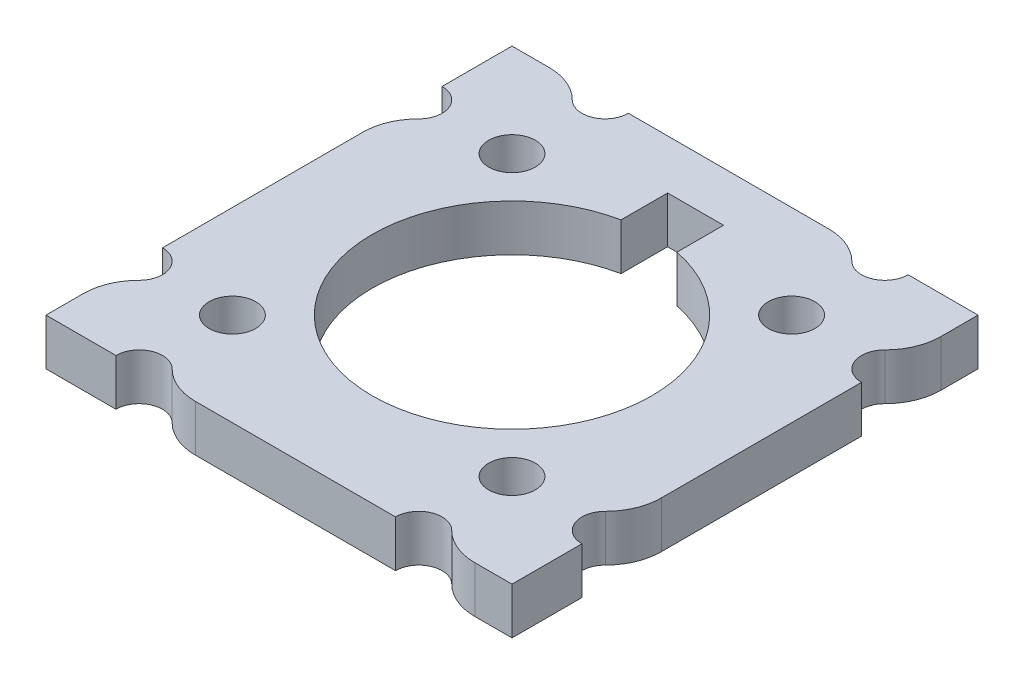
from build123d import *

# Parameters (mm, degrees)
SKETCH1_W           = 50
SKETCH1_H           = 50
SKETCH1_R           = 2.5
BOSS_EXTRUDE1_DEPTH = 5
SKETCH2_R           = 2.5
CUT_EXTRUDE1_DEPTH  = 5
CUT_EXTRUDE2_DEPTH  = 36.707142143
FILLET1_R           = 6


with BuildPart() as part:
    # Sketch1 → Boss-Extrude1 (new body)
    with BuildSketch(Plane(origin=(0, 0, 0), x_dir=(1, 0, 0), z_dir=(0, 1, 0))):
        Rectangle(SKETCH1_W, SKETCH1_H)
        with Locations(Location((15, 15, 0), (0, 0, 270))):
            Circle(SKETCH1_R, mode=Mode.SUBTRACT)
        with Locations(Location((15, -15, 0), (0, 0, 270))):
            Circle(SKETCH1_R, mode=Mode.SUBTRACT)
        with Locations(Location((-15, -15, 0), (0, 0, 90))):
            Circle(SKETCH1_R, mode=Mode.SUBTRACT)
        with Locations(Location((-15, 15, 0), (0, 0, 90))):
            Circle(SKETCH1_R, mode=Mode.SUBTRACT)
    extrude(amount=BOSS_EXTRUDE1_DEPTH)

    # Sketch2 → Cut-Extrude1 (cut)
    with BuildSketch(Plane(origin=(0, 5, 0), x_dir=(1, 0, 0), z_dir=(0, 1, 0))):
        with Locations((25, 15)):
            Circle(SKETCH2_R)
        with Locations((25, -15)):
            Circle(SKETCH2_R)
        with Locations((-25, 15)):
            Circle(SKETCH2_R)
        with Locations((-25, -15)):
            Circle(SKETCH2_R)
        with Locations((-15, 25)):
            Circle(SKETCH2_R)
        with Locations((15, 25)):
            Circle(SKETCH2_R)
        with Locations((15, -25)):
            Circle(SKETCH2_R)
        with Locations((-15, -25)):
            Circle(SKETCH2_R)
    extrude(amount=-CUT_EXTRUDE1_DEPTH, mode=Mode.SUBTRACT)

    # Sketch3 → Cut-Extrude2 (cut, through all)
    with BuildSketch(Plane(origin=(0, 5, 0), x_dir=(1, 0, 0), z_dir=(0, 1, 0))):
        with BuildLine():
            Line((-3, 19.696938457), (3, 19.696938457))
            Line((3, 19.696938457), (3, 14.696938457))
            ThreePointArc((3, 14.696938457), (0, -15), (-3, 14.696938457))
            Line((-3, 14.696938457), (-3, 19.696938457))
        make_face()
    extrude(amount=-CUT_EXTRUDE2_DEPTH, mode=Mode.SUBTRACT)

    # Fillet1
    fillet1_edges = [part.edges().sort_by_distance(p)[0] for p in [
        (-12.5, 2.5, 25),
        (17.5, 2.5, 25),
        (-25, 2.5, -12.5),
        (-25, 2.5, 17.5),
        (12.5, 2.5, -25),
        (-17.5, 2.5, -25),
        (25, 2.5, -17.5),
        (25, 2.5, 12.5),
    ]]
    fillet(fillet1_edges, radius=FILLET1_R)


solid = part.part
